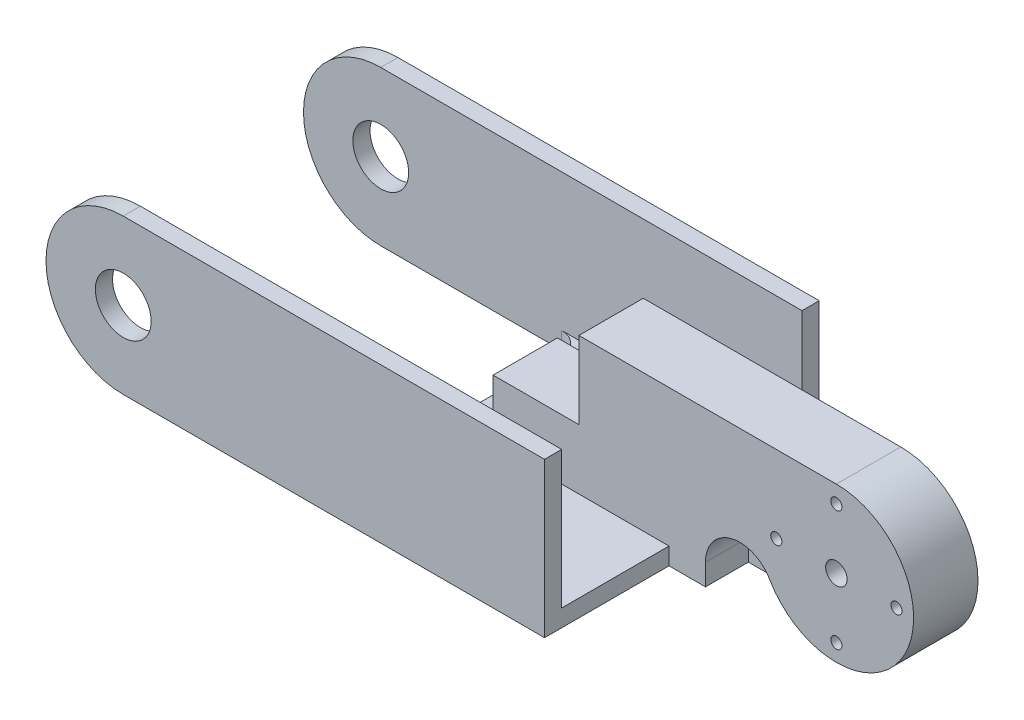
from build123d import *

# Parameters (mm, degrees)
BOSS_EXTRUDE1_DEPTH       = 4
SKETCH2_W                 = 51
SKETCH2_H                 = 4
BOSS_EXTRUDE2_DEPTH       = 16
BOSS_EXTRUDE3_DEPTH       = 15
SKETCH4_W                 = 51
SKETCH4_H                 = 4
BOSS_EXTRUDE4_DEPTH       = 25
BOSS_EXTRUDE5_DEPTH       = 4
SKETCH6_R                 = 6.5
CUT_EXTRUDE1_DEPTH        = 138.431688125
SKETCH7_R                 = 2.5
CUT_EXTRUDE2_DEPTH        = 127.55618871
CUT_EXTRUDE7_DEPTH        = 10
M3X0_5_TAPPED_HOLE1_D     = 2.6
M3X0_5_TAPPED_HOLE1_DEPTH = 9
M3X0_5_TAPPED_HOLE1_TIP   = 0.781118805
FILLET1_R                 = 5


with BuildPart() as part:
    # Sketch1 → Boss-Extrude1 (new body)
    with BuildSketch(Plane.XY):
        with BuildLine():
            Line((0, 0), (-98.17, 0))
            ThreePointArc((-98.17, 0), (-116.17, 18), (-98.17, 36))
            Line((-98.17, 36), (0, 36))
            Line((0, 36), (0, 0))
        make_face()
    extrude(amount=BOSS_EXTRUDE1_DEPTH)

    # Sketch2 → Boss-Extrude2 (add)
    with BuildSketch(Plane.XY.offset(4)):
        with Locations((-25.5, 2)):
            Rectangle(SKETCH2_W, SKETCH2_H)
    extrude(amount=BOSS_EXTRUDE2_DEPTH)

    # Sketch3 → Boss-Extrude3 (add)
    with BuildSketch(Plane.XY.offset(20)):
        with BuildLine():
            Line((-51, 1.1e-08), (-51, 4.000000011))
            Line((-51, 4.000000011), (-41, 4.000000011))
            Line((-41, 4.000000011), (-41, 18.000000011))
            Line((-41, 18.000000011), (-21, 18.000000011))
            Line((-21, 18.000000011), (-21, 36.000000011))
            Line((-21, 36.000000011), (39.000002857, 35.999993821))
            ThreePointArc((39.000002857, 35.999993821), (56.999993821, 17.999998572), (39, 6.179e-06))
            Line((39, 6.179e-06), (-51, 1.1e-08))
        make_face()
    extrude(amount=BOSS_EXTRUDE3_DEPTH)

    # Sketch4 → Boss-Extrude4 (add)
    with BuildSketch(Plane.XY.offset(35)):
        with Locations((-25.5, 2)):
            Rectangle(SKETCH4_W, SKETCH4_H)
    extrude(amount=BOSS_EXTRUDE4_DEPTH)

    # Sketch5 → Boss-Extrude5 (add)
    with BuildSketch(Plane.XY.offset(60)):
        with BuildLine():
            Line((0, 0), (-98.17, 0))
            ThreePointArc((-98.17, 0), (-116.17, 18), (-98.17, 36))
            Line((-98.17, 36), (0, 36))
            Line((0, 36), (0, 0))
        make_face()
    extrude(amount=BOSS_EXTRUDE5_DEPTH)

    # Sketch6 → Cut-Extrude1 (cut, through all)
    with BuildSketch(Plane.XY.offset(64)):
        with Locations((-98.17, 18)):
            Circle(SKETCH6_R)
    extrude(amount=-CUT_EXTRUDE1_DEPTH, mode=Mode.SUBTRACT)

    # Sketch7 → Cut-Extrude2 (cut, through all)
    with BuildSketch(Plane.XY.offset(35)):
        with Locations((39, 18)):
            Circle(SKETCH7_R)
    extrude(amount=-CUT_EXTRUDE2_DEPTH, mode=Mode.SUBTRACT)

    # Sketch8 → Cut-Extrude7 (cut)
    with BuildSketch(Plane.XY.offset(35)):
        with BuildLine():
            Line((8.498741262, 4.973372122), (8.498741262, 0))
            Line((8.498741262, 0), (39, 6.179e-06))
            ThreePointArc((39, 6.179e-06), (30.025855334, 2.408885262), (23.448763614, 8.972408358))
            ThreePointArc((23.448763614, 8.972408358), (14.431387141, 12.738878418), (8.498741262, 4.973372122))
        make_face()
    extrude(amount=-CUT_EXTRUDE7_DEPTH, mode=Mode.SUBTRACT)

    # M3x0.5 Tapped Hole1
    with Locations(Plane.XY.offset(35)):
        with Locations((39, 32), (25, 18), (39, 4), (53, 18)):
            Hole(M3X0_5_TAPPED_HOLE1_D / 2, depth=M3X0_5_TAPPED_HOLE1_DEPTH)
            with Locations((0, 0, -(M3X0_5_TAPPED_HOLE1_DEPTH + M3X0_5_TAPPED_HOLE1_TIP / 2))):  # 118° drill point
                Cone(0, M3X0_5_TAPPED_HOLE1_D / 2, M3X0_5_TAPPED_HOLE1_TIP, mode=Mode.SUBTRACT)

    # Fillet1
    fillet1_edges = [part.edges().sort_by_distance(p)[0] for p in [
        (-51, 2, 4),
        (-51, 2, 60),
    ]]
    fillet(fillet1_edges, radius=FILLET1_R)


solid = part.part
